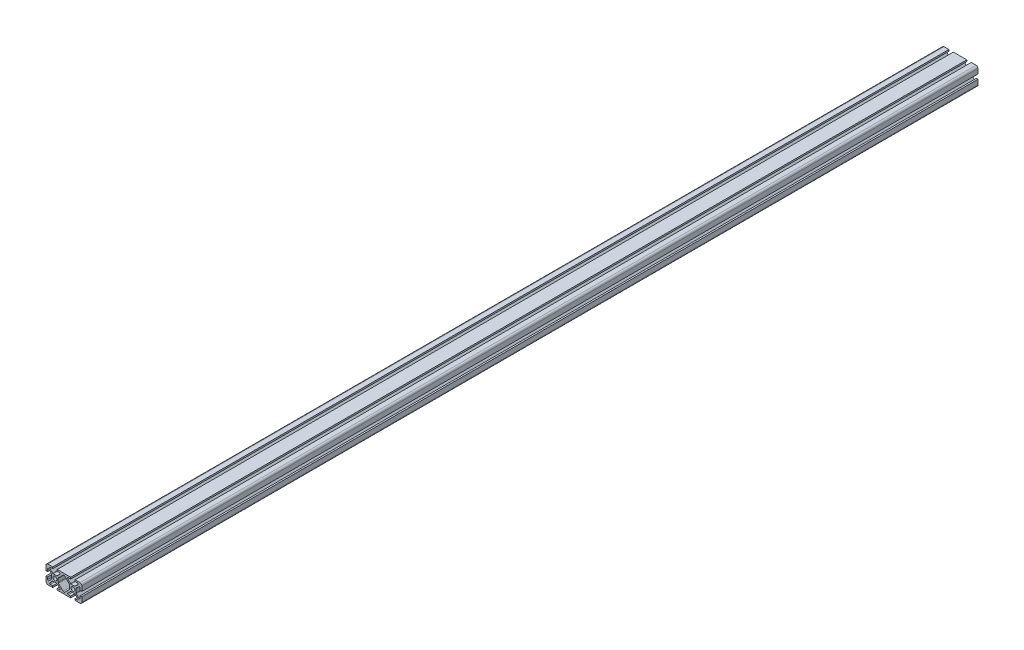
from build123d import *

# Parameters (mm, degrees)
BOSS_EXTRUDE1_DEPTH = 1524
BOSS_EXTRUDE2_DEPTH = 1524
FILLET1_R           = 0.75
FILLET2_R           = 1.25
SKETCH5_W           = 2048
SKETCH5_H           = 20
CUT_EXTRUDE1_DEPTH  = 1525.55764076


with BuildPart() as part:
    # Sketch3 → Boss-Extrude1 (new, symmetric)
    with BuildSketch(Plane.XY):
        with BuildLine():
            Line((12.5, -10), (17.9, -10))
            ThreePointArc((17.9, -10), (19.38492424, -9.38492424), (20, -7.9))
            Line((20, -7.9), (20, -2.5))
            Line((20, -2.5), (18.213351365, -2.5))
            Line((18.213351365, -2.5), (18.213351365, -6.95))
            Line((18.213351365, -6.95), (13.6, -2.336648635))
            Line((13.6, -2.336648635), (13.6, 0))
            Line((13.6, 0), (12.15, 0))
            ThreePointArc((12.15, 0), (11.52027958, -1.52027958), (10, -2.15))
            Line((10, -2.15), (10, -3.6))
            Line((10, -3.6), (12.336648635, -3.6))
            Line((12.336648635, -3.6), (16.95, -8.213351365))
            Line((16.95, -8.213351365), (12.5, -8.213351365))
            Line((12.5, -8.213351365), (12.5, -10))
        make_face()
    extrude(amount=BOSS_EXTRUDE1_DEPTH, both=True)

    # Sketch4 → Boss-Extrude2 (add, symmetric)
    with BuildSketch(Plane.XY):
        with BuildLine():
            Line((10, -3.6), (7.663351365, -3.6))
            Line((7.663351365, -3.6), (3.05, -8.213351365))
            Line((3.05, -8.213351365), (7.5, -8.213351365))
            Line((7.5, -8.213351365), (7.5, -10))
            Line((7.5, -10), (0, -10))
            Line((0, -10), (0, -8.736648635))
            Line((0, -8.736648635), (6.4, -2.336648635))
            Line((6.4, -2.336648635), (6.4, 0))
            Line((6.4, 0), (7.85, 0))
            ThreePointArc((7.85, 0), (8.47972042, -1.52027958), (10, -2.15))
            Line((10, -2.15), (10, -3.6))
        make_face()
    extrude(amount=BOSS_EXTRUDE2_DEPTH, both=True)

    # Mirror1: part across plane


with BuildPart() as part_1:
    add(part.part)
    add(part.part.mirror(Plane(origin=(0, 0, 0), x_dir=(0, 0, 1), z_dir=(1, 0, 0))))

    # Mirror2: part across plane


with BuildPart() as part_2:
    add(part_1.part)
    add(part_1.part.mirror(Plane.ZX))

    # Fillet1
    fillet1_edges = [part_2.edges().sort_by_distance(p)[0] for p in [
        (18.213351365, 6.95, 0),
        (13.6, 2.336648635, 0),
        (12.336648635, 3.6, 0),
        (16.95, 8.213351365, 0),
        (3.05, 8.213351365, 0),
        (7.663351365, 3.6, 0),
        (-18.213351365, 6.95, 0),
        (-13.6, 2.336648635, 0),
        (-7.663351365, 3.6, 0),
        (-12.336648635, 3.6, 0),
        (-16.95, 8.213351365, 0),
        (-3.05, 8.213351365, 0),
        (16.95, -8.213351365, 0),
        (12.336648635, -3.6, 0),
        (13.6, -2.336648635, 0),
        (18.213351365, -6.95, 0),
        (3.05, -8.213351365, 0),
        (7.663351365, -3.6, 0),
        (-18.213351365, -6.95, 0),
        (-13.6, -2.336648635, 0),
        (-12.336648635, -3.6, 0),
        (-16.95, -8.213351365, 0),
        (-3.05, -8.213351365, 0),
        (-7.663351365, -3.6, 0),
    ]]
    fillet(fillet1_edges, radius=FILLET1_R)

    # Fillet2
    fillet2_edges = [part_2.edges().sort_by_distance(p)[0] for p in [
        (6.4, 2.336648635, 0),
        (0, 8.736648635, 0),
        (-6.4, 2.336648635, 0),
        (6.4, -2.336648635, 0),
        (-6.4, -2.336648635, 0),
        (0, -8.736648635, 0),
    ]]
    fillet(fillet2_edges, radius=FILLET2_R)

    # Sketch5 → Cut-Extrude1 (cut, through all)
    with BuildSketch(Plane.ZY.offset(20)):
        with Locations((500, 0)):
            Rectangle(SKETCH5_W, SKETCH5_H)
    extrude(amount=-CUT_EXTRUDE1_DEPTH, mode=Mode.SUBTRACT)


solid = part_2.part
